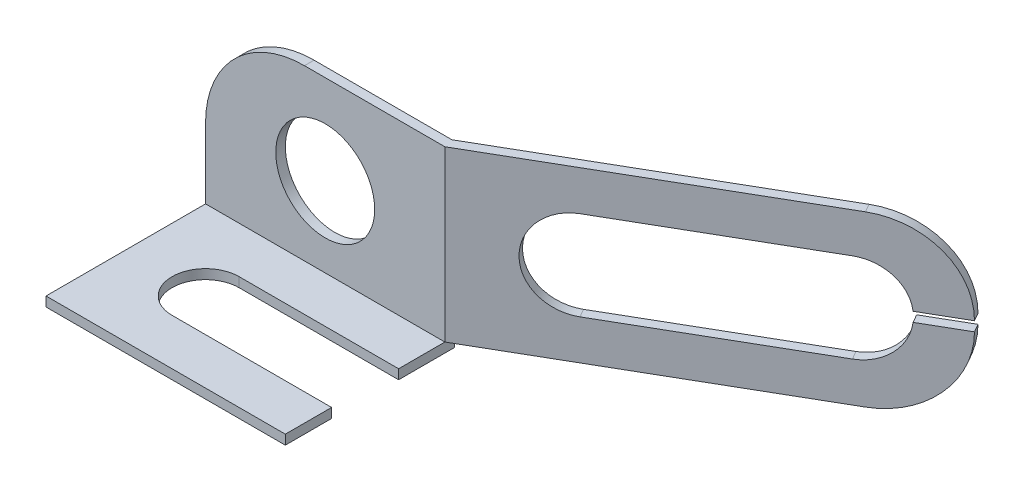
from build123d import *

# Parameters (mm, degrees)
SKETCH1_W           = 1500
SKETCH1_H           = 60
BOSS_EXTRUDE1_DEPTH = 1000
SKETCH1_6_R         = 310
BOSS_EXTRUDE2_DEPTH = 60
SKETCH4_W           = 1500
SKETCH4_H           = 60
BOSS_EXTRUDE3_DEPTH = 60
CUT_EXTRUDE2_DEPTH  = 60
BOSS_EXTRUDE4_DEPTH = 60


with BuildPart() as part:
    # Sketch1 → Boss-Extrude1 (new body)
    with BuildSketch(Plane.XY):
        with Locations((0, -560)):
            Rectangle(SKETCH1_W, SKETCH1_H)
    extrude(amount=BOSS_EXTRUDE1_DEPTH)



with BuildPart() as body_2:
    # Sketch1<6> → Boss-Extrude2 (new body)
    with BuildSketch(Plane.XY):
        with BuildLine():
            Line((750, 530), (-130, 530))
            ThreePointArc((-130, 530), (-568.406204336, 348.406204336), (-750, -90))
            Line((-750, -90), (-750, -530))
            Line((-750, -530), (750, -530))
            Line((750, -530), (750, 530))
        make_face()
        with Locations((0, -30)):
            Circle(SKETCH1_6_R, mode=Mode.SUBTRACT)
    extrude(amount=-BOSS_EXTRUDE2_DEPTH)


with BuildPart() as part_1:
    add(part.part)

    add(body_2.part)  # Boss-Extrude3 merges body 2
    # Sketch4 → Boss-Extrude3 (add)
    with BuildSketch(Plane.XZ.offset(530)):
        with Locations((0, -30)):
            Rectangle(SKETCH4_W, SKETCH4_H)
    extrude(amount=BOSS_EXTRUDE3_DEPTH)

    # Sketch5 → Cut-Extrude2 (cut)
    with BuildSketch(Plane(origin=(0, -530, 0), x_dir=(1, 0, 0), z_dir=(0, 1, 0))):
        with BuildLine():
            Line((-250, -710), (750, -710))
            Line((750, -710), (750, -290))
            Line((750, -290), (-250, -290))
            ThreePointArc((-250, -290), (-460, -500), (-250, -710))
        make_face()
    extrude(amount=-CUT_EXTRUDE2_DEPTH, mode=Mode.SUBTRACT)

    # Sketch6 → Boss-Extrude4 (add)
    with BuildSketch(Plane(origin=(187.5, 0, 324.759526419), x_dir=(0, 1, 0), z_dir=(-0.5000000000000071, -9.251858538543111e-15, -0.8660254037844346))):
        with BuildLine():
            Line((-530, 649.519052838), (530, 649.519052838))
            Line((530, 649.519052838), (530, 2579.519052838))
            ThreePointArc((530, 2579.519052838), (383.553390593, 2933.072443432), (30, 3079.519052838))
            Line((30, 3079.519052838), (30, 2797.90727098))
            ThreePointArc((30, 2797.90727098), (208.32666656, 2706.601922177), (280, 2519.519052838))
            Line((280, 2519.519052838), (280, 1269.519052838))
            ThreePointArc((280, 1269.519052838), (0, 989.519052838), (-280, 1269.519052838))
            Line((-280, 1269.519052838), (-280, 2519.519052838))
            ThreePointArc((-280, 2519.519052838), (-208.32666656, 2706.601922177), (-30, 2797.90727098))
            Line((-30, 2797.90727098), (-30, 3079.519052838))
            ThreePointArc((-30, 3079.519052838), (-383.553390593, 2933.072443432), (-530, 2579.519052838))
            Line((-530, 2579.519052838), (-530, 649.519052838))
        make_face()
    extrude(amount=BOSS_EXTRUDE4_DEPTH)


solid = part_1.part
